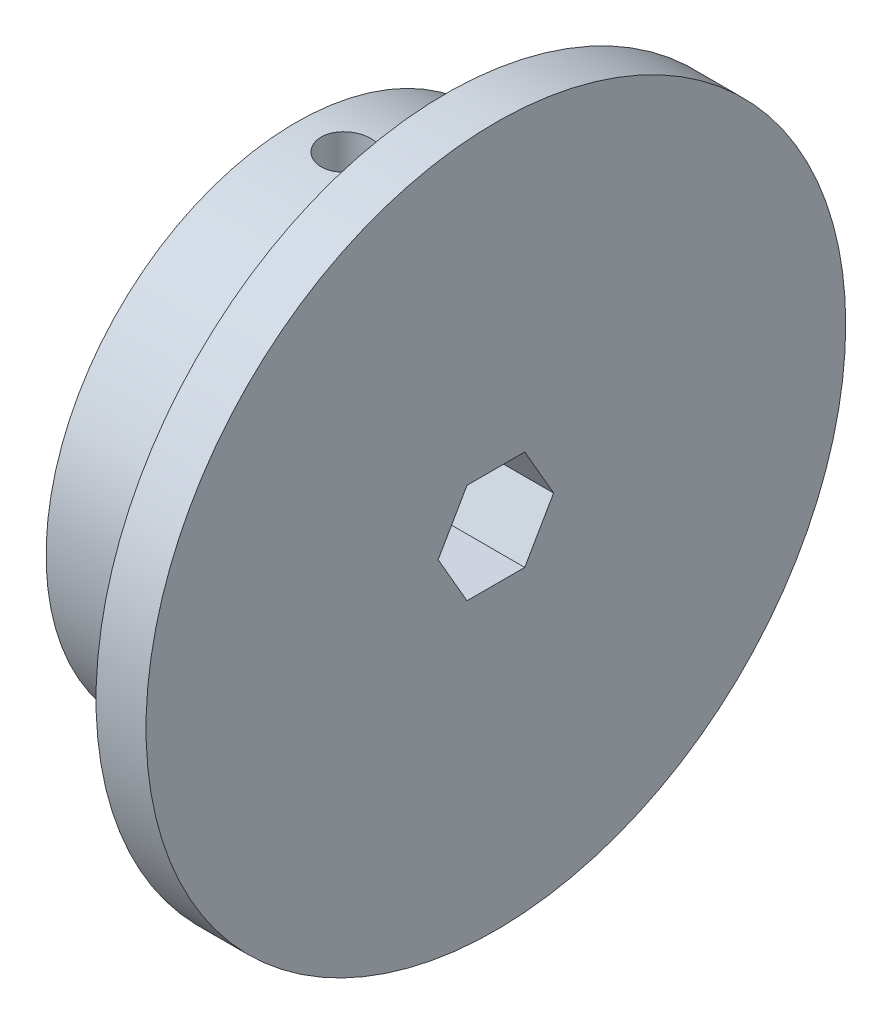
from build123d import *

# Parameters (mm, degrees)
SKETCH1_R               = 44.45
BOSS_EXTRUDE1_DEPTH     = 6.35
SKETCH2_R               = 31.75
BOSS_EXTRUDE2_DEPTH     = 19.05
CUT_EXTRUDE1_DEPTH      = 66.684910748
CUT_EXTRUDE1_DEPTH_BACK = 66.684910748
SKETCH3_R               = 3.139622981


with BuildPart() as part:
    # Sketch1 → Boss-Extrude1 (new body)
    with BuildSketch(Plane(origin=(0, 0, 0), x_dir=(0, 0, -1), z_dir=(1, 0, 0))):
        Circle(SKETCH1_R)
        Polygon((3.666174209, -6.35), (7.332348419, 0), (3.666174209, 6.35), (-3.666174209, 6.35), (-7.332348419, 0), (-3.666174209, -6.35), align=None, mode=Mode.SUBTRACT)
    extrude(amount=BOSS_EXTRUDE1_DEPTH)

    # Sketch2 → Boss-Extrude2 (add)
    with BuildSketch(Plane(origin=(0, 0, 0), x_dir=(0, 0, -1), z_dir=(1, 0, 0))):
        Circle(SKETCH2_R)
        Polygon((-7.332348419, 0), (-3.666174209, -6.35), (3.666174209, -6.35), (7.332348419, 0), (3.666174209, 6.35), (-3.666174209, 6.35), align=None, mode=Mode.SUBTRACT)
    extrude(amount=-BOSS_EXTRUDE2_DEPTH)

    # Sketch3 → Cut-Extrude1 (cut, two sides: drawn at the far end of the back side and taken through both)
    with BuildSketch(Plane(origin=(0, 0, 0), x_dir=(1, 0, 0), z_dir=(0, 1, 0)).offset(-CUT_EXTRUDE1_DEPTH_BACK)):
        with Locations(Location((-12.7, 0, 0), (0, 0, 270))):
            Circle(SKETCH3_R)
    extrude(amount=CUT_EXTRUDE1_DEPTH + CUT_EXTRUDE1_DEPTH_BACK, mode=Mode.SUBTRACT)


solid = part.part
